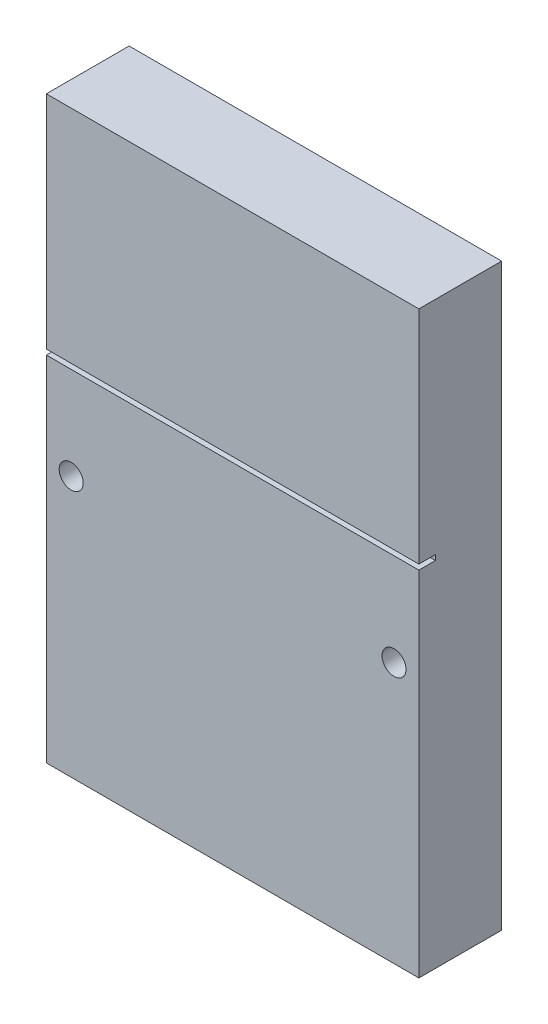
from build123d import *

# Parameters (mm, degrees)
SKETCH2_W           = 45
SKETCH2_H           = 10
BOSS_EXTRUDE1_DEPTH = 40
SKETCH4_W           = 45
SKETCH4_H           = 10
BOSS_EXTRUDE2_DEPTH = 10
SKETCH8_W           = 45
SKETCH8_H           = 10
BOSS_EXTRUDE3_DEPTH = 20
SKETCH9_R           = 1.45
CUT_EXTRUDE2_DEPTH  = 20
SKETCH10_W          = 45
SKETCH10_H          = 0.626165357
CUT_EXTRUDE3_DEPTH  = 2


with BuildPart() as part:
    # Sketch2 → Boss-Extrude1 (new body)
    with BuildSketch(Plane(origin=(0, 0, 0), x_dir=(1, 0, 0), z_dir=(0, 1, 0))):
        Rectangle(SKETCH2_W, SKETCH2_H)
    extrude(amount=BOSS_EXTRUDE1_DEPTH)

    # Sketch4 → Boss-Extrude2 (add)
    with BuildSketch(Plane(origin=(0, 40, 0), x_dir=(1, 0, 0), z_dir=(0, 1, 0))):
        Rectangle(SKETCH4_W, SKETCH4_H)
    extrude(amount=BOSS_EXTRUDE2_DEPTH)

    # Sketch8 → Boss-Extrude3 (add)
    with BuildSketch(Plane.XZ):
        Rectangle(SKETCH8_W, SKETCH8_H)
    extrude(amount=BOSS_EXTRUDE3_DEPTH)

    # Sketch9 → Cut-Extrude2 (cut)
    with BuildSketch(Plane.XY.offset(5)):
        with Locations((19.5, 11.5)):
            Circle(SKETCH9_R)
        with Locations((-19.5, 11.5)):
            Circle(SKETCH9_R)
    extrude(amount=-CUT_EXTRUDE2_DEPTH, mode=Mode.SUBTRACT)

    # Sketch10 → Cut-Extrude3 (cut)
    with BuildSketch(Plane.XY.offset(5)):
        with Locations((0, 22.984410254)):
            Rectangle(SKETCH10_W, SKETCH10_H)
    extrude(amount=-CUT_EXTRUDE3_DEPTH, mode=Mode.SUBTRACT)


solid = part.part
